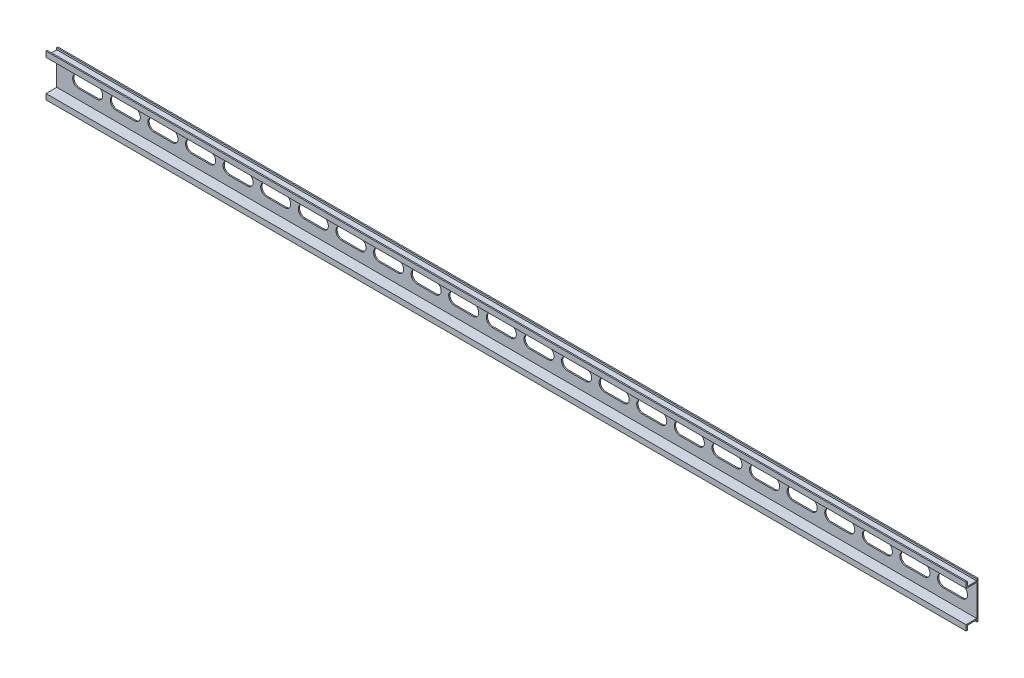
from build123d import *

# Parameters (mm, degrees)
BOSS_EXTRUDE1_DEPTH = 762
CUT_EXTRUDE1_DEPTH  = 763.26589161


with BuildPart() as part:
    # Sketch1 → Boss-Extrude1 (new body)
    with BuildSketch(Plane(origin=(0, 0, 0), x_dir=(0, 0, -1), z_dir=(1, 0, 0))):
        Polygon((0, 12.954), (0, -12.954), (-8.89, -12.954), (-8.89, -17.526), (-7.874, -17.526), (-7.874, -13.97), (0, -13.97), (0, -15.494), (1.016, -15.494), (1.016, 15.494), (0, 15.494), (0, 13.97), (-7.874, 13.97), (-7.874, 17.526), (-8.89, 17.526), (-8.89, 12.954), align=None)
    extrude(amount=BOSS_EXTRUDE1_DEPTH)

    # Sketch2 → Cut-Extrude1 (cut, through all)
    with BuildSketch(Plane(origin=(0, 0, -1.016), x_dir=(-1, 0, 0), z_dir=(0, 0, -1))):
        with BuildLine():
            Line((-749.554, 4.826), (-734.314, 4.826))
            ThreePointArc((-734.314, 4.826), (-729.488, 0), (-734.314, -4.826))
            Line((-734.314, -4.826), (-749.554, -4.826))
            ThreePointArc((-749.554, -4.826), (-754.38, 0), (-749.554, 4.826))
        make_face()
        with BuildLine():
            Line((-718.411391304, 4.826), (-703.171391304, 4.826))
            ThreePointArc((-703.171391304, 4.826), (-698.345391304, 0), (-703.171391304, -4.826))
            Line((-703.171391304, -4.826), (-718.411391304, -4.826))
            ThreePointArc((-718.411391304, -4.826), (-723.237391304, 0), (-718.411391304, 4.826))
        make_face()
        with BuildLine():
            Line((-687.268782609, 4.826), (-672.028782609, 4.826))
            ThreePointArc((-672.028782609, 4.826), (-667.202782609, 0), (-672.028782609, -4.826))
            Line((-672.028782609, -4.826), (-687.268782609, -4.826))
            ThreePointArc((-687.268782609, -4.826), (-692.094782609, 0), (-687.268782609, 4.826))
        make_face()
        with BuildLine():
            Line((-656.126173913, 4.826), (-640.886173913, 4.826))
            ThreePointArc((-640.886173913, 4.826), (-636.060173913, 0), (-640.886173913, -4.826))
            Line((-640.886173913, -4.826), (-656.126173913, -4.826))
            ThreePointArc((-656.126173913, -4.826), (-660.952173913, 0), (-656.126173913, 4.826))
        make_face()
        with BuildLine():
            Line((-624.983565217, 4.826), (-609.743565217, 4.826))
            ThreePointArc((-609.743565217, 4.826), (-604.917565217, 0), (-609.743565217, -4.826))
            Line((-609.743565217, -4.826), (-624.983565217, -4.826))
            ThreePointArc((-624.983565217, -4.826), (-629.809565217, 0), (-624.983565217, 4.826))
        make_face()
        with BuildLine():
            Line((-593.840956522, 4.826), (-578.600956522, 4.826))
            ThreePointArc((-578.600956522, 4.826), (-573.774956522, 0), (-578.600956522, -4.826))
            Line((-578.600956522, -4.826), (-593.840956522, -4.826))
            ThreePointArc((-593.840956522, -4.826), (-598.666956522, 0), (-593.840956522, 4.826))
        make_face()
        with BuildLine():
            Line((-562.698347826, 4.826), (-547.458347826, 4.826))
            ThreePointArc((-547.458347826, 4.826), (-542.632347826, 0), (-547.458347826, -4.826))
            Line((-547.458347826, -4.826), (-562.698347826, -4.826))
            ThreePointArc((-562.698347826, -4.826), (-567.524347826, 0), (-562.698347826, 4.826))
        make_face()
        with BuildLine():
            Line((-531.55573913, 4.826), (-516.31573913, 4.826))
            ThreePointArc((-516.31573913, 4.826), (-511.48973913, 0), (-516.31573913, -4.826))
            Line((-516.31573913, -4.826), (-531.55573913, -4.826))
            ThreePointArc((-531.55573913, -4.826), (-536.38173913, 0), (-531.55573913, 4.826))
        make_face()
        with BuildLine():
            Line((-500.413130435, 4.826), (-485.173130435, 4.826))
            ThreePointArc((-485.173130435, 4.826), (-480.347130435, 0), (-485.173130435, -4.826))
            Line((-485.173130435, -4.826), (-500.413130435, -4.826))
            ThreePointArc((-500.413130435, -4.826), (-505.239130435, 0), (-500.413130435, 4.826))
        make_face()
        with BuildLine():
            Line((-469.270521739, 4.826), (-454.030521739, 4.826))
            ThreePointArc((-454.030521739, 4.826), (-449.204521739, 0), (-454.030521739, -4.826))
            Line((-454.030521739, -4.826), (-469.270521739, -4.826))
            ThreePointArc((-469.270521739, -4.826), (-474.096521739, 0), (-469.270521739, 4.826))
        make_face()
        with BuildLine():
            Line((-438.127913043, 4.826), (-422.887913043, 4.826))
            ThreePointArc((-422.887913043, 4.826), (-418.061913043, 0), (-422.887913043, -4.826))
            Line((-422.887913043, -4.826), (-438.127913043, -4.826))
            ThreePointArc((-438.127913043, -4.826), (-442.953913043, 0), (-438.127913043, 4.826))
        make_face()
        with BuildLine():
            Line((-406.985304348, 4.826), (-391.745304348, 4.826))
            ThreePointArc((-391.745304348, 4.826), (-386.919304348, 0), (-391.745304348, -4.826))
            Line((-391.745304348, -4.826), (-406.985304348, -4.826))
            ThreePointArc((-406.985304348, -4.826), (-411.811304348, 0), (-406.985304348, 4.826))
        make_face()
        with BuildLine():
            Line((-375.842695652, 4.826), (-360.602695652, 4.826))
            ThreePointArc((-360.602695652, 4.826), (-355.776695652, 0), (-360.602695652, -4.826))
            Line((-360.602695652, -4.826), (-375.842695652, -4.826))
            ThreePointArc((-375.842695652, -4.826), (-380.668695652, 0), (-375.842695652, 4.826))
        make_face()
        with BuildLine():
            Line((-344.700086957, 4.826), (-329.460086957, 4.826))
            ThreePointArc((-329.460086957, 4.826), (-324.634086957, 0), (-329.460086957, -4.826))
            Line((-329.460086957, -4.826), (-344.700086957, -4.826))
            ThreePointArc((-344.700086957, -4.826), (-349.526086957, 0), (-344.700086957, 4.826))
        make_face()
        with BuildLine():
            Line((-313.557478261, 4.826), (-298.317478261, 4.826))
            ThreePointArc((-298.317478261, 4.826), (-293.491478261, 0), (-298.317478261, -4.826))
            Line((-298.317478261, -4.826), (-313.557478261, -4.826))
            ThreePointArc((-313.557478261, -4.826), (-318.383478261, 0), (-313.557478261, 4.826))
        make_face()
        with BuildLine():
            Line((-282.414869565, 4.826), (-267.174869565, 4.826))
            ThreePointArc((-267.174869565, 4.826), (-262.348869565, 0), (-267.174869565, -4.826))
            Line((-267.174869565, -4.826), (-282.414869565, -4.826))
            ThreePointArc((-282.414869565, -4.826), (-287.240869565, 0), (-282.414869565, 4.826))
        make_face()
        with BuildLine():
            Line((-251.27226087, 4.826), (-236.03226087, 4.826))
            ThreePointArc((-236.03226087, 4.826), (-231.20626087, 0), (-236.03226087, -4.826))
            Line((-236.03226087, -4.826), (-251.27226087, -4.826))
            ThreePointArc((-251.27226087, -4.826), (-256.09826087, 0), (-251.27226087, 4.826))
        make_face()
        with BuildLine():
            Line((-220.129652174, 4.826), (-204.889652174, 4.826))
            ThreePointArc((-204.889652174, 4.826), (-200.063652174, 0), (-204.889652174, -4.826))
            Line((-204.889652174, -4.826), (-220.129652174, -4.826))
            ThreePointArc((-220.129652174, -4.826), (-224.955652174, 0), (-220.129652174, 4.826))
        make_face()
        with BuildLine():
            Line((-188.987043478, 4.826), (-173.747043478, 4.826))
            ThreePointArc((-173.747043478, 4.826), (-168.921043478, 0), (-173.747043478, -4.826))
            Line((-173.747043478, -4.826), (-188.987043478, -4.826))
            ThreePointArc((-188.987043478, -4.826), (-193.813043478, 0), (-188.987043478, 4.826))
        make_face()
        with BuildLine():
            Line((-157.844434783, 4.826), (-142.604434783, 4.826))
            ThreePointArc((-142.604434783, 4.826), (-137.778434783, 0), (-142.604434783, -4.826))
            Line((-142.604434783, -4.826), (-157.844434783, -4.826))
            ThreePointArc((-157.844434783, -4.826), (-162.670434783, 0), (-157.844434783, 4.826))
        make_face()
        with BuildLine():
            Line((-126.701826087, 4.826), (-111.461826087, 4.826))
            ThreePointArc((-111.461826087, 4.826), (-106.635826087, 0), (-111.461826087, -4.826))
            Line((-111.461826087, -4.826), (-126.701826087, -4.826))
            ThreePointArc((-126.701826087, -4.826), (-131.527826087, 0), (-126.701826087, 4.826))
        make_face()
        with BuildLine():
            Line((-95.559217391, 4.826), (-80.319217391, 4.826))
            ThreePointArc((-80.319217391, 4.826), (-75.493217391, 0), (-80.319217391, -4.826))
            Line((-80.319217391, -4.826), (-95.559217391, -4.826))
            ThreePointArc((-95.559217391, -4.826), (-100.385217391, 0), (-95.559217391, 4.826))
        make_face()
        with BuildLine():
            Line((-64.416608696, 4.826), (-49.176608696, 4.826))
            ThreePointArc((-49.176608696, 4.826), (-44.350608696, 0), (-49.176608696, -4.826))
            Line((-49.176608696, -4.826), (-64.416608696, -4.826))
            ThreePointArc((-64.416608696, -4.826), (-69.242608696, 0), (-64.416608696, 4.826))
        make_face()
        with BuildLine():
            Line((-33.274, 4.826), (-18.034, 4.826))
            ThreePointArc((-18.034, 4.826), (-13.208, 0), (-18.034, -4.826))
            Line((-18.034, -4.826), (-33.274, -4.826))
            ThreePointArc((-33.274, -4.826), (-38.1, 0), (-33.274, 4.826))
        make_face()
    extrude(amount=-CUT_EXTRUDE1_DEPTH, mode=Mode.SUBTRACT)


solid = part.part
